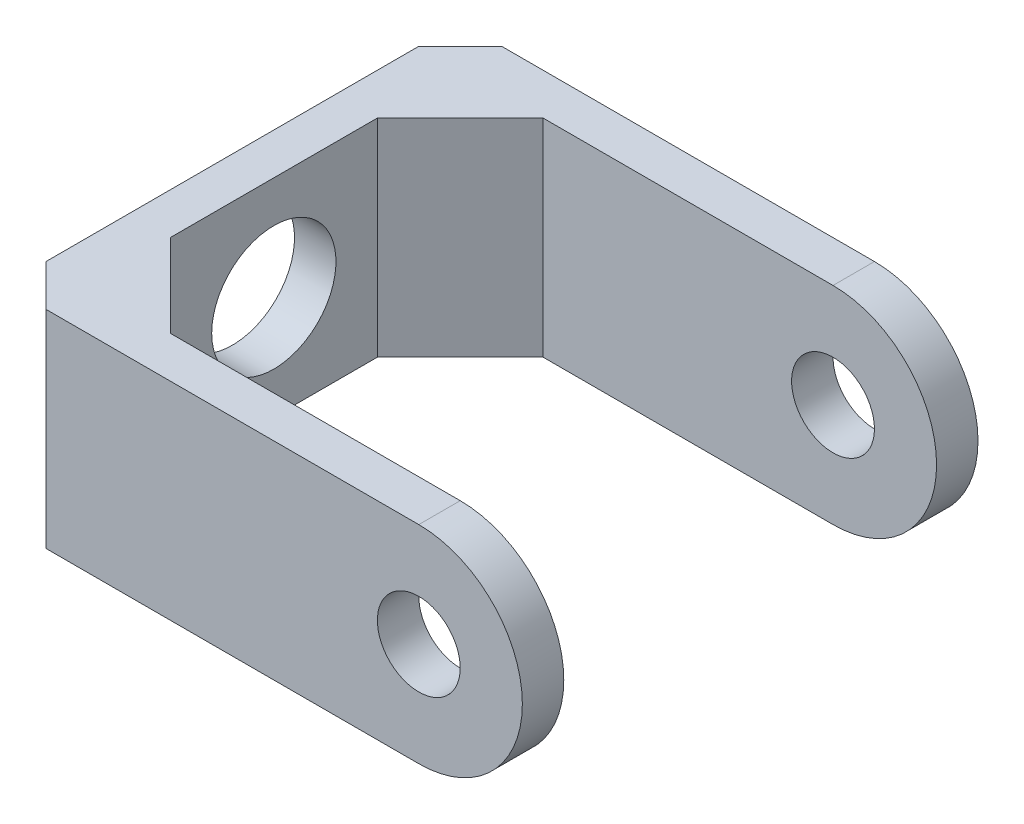
from build123d import *

# Parameters (mm, degrees)
SKETCH_1_R          = 2
EXTRUDE_1_DEPTH     = 2
SKETCH_6_W          = 22
SKETCH_6_H          = 10
EXTRUDE_5_DEPTH     = 2
CHAMFER_2_SIZE      = 2
CHAMFER_3_SIZE      = 4
SKETCH_7_R          = 3
CUT_EXTRUDE_2_DEPTH = 35.770677301


with BuildPart() as part:
    # 草图1 → 凸台-拉伸1 (new body)
    with BuildSketch(Plane.XY):
        with BuildLine():
            Line((0, 0), (18, 0))
            ThreePointArc((18, 0), (23, 5), (18, 10))
            Line((18, 10), (0, 10))
            Line((0, 10), (0, 0))
        make_face()
        with Locations((18, 5)):
            Circle(SKETCH_1_R, mode=Mode.SUBTRACT)
    extrude(amount=EXTRUDE_1_DEPTH)


with BuildPart() as body_2:
    # 镜向1: mirrored copy
    add(part.part.mirror(Plane.XY.offset(11)))


with BuildPart() as part_1:
    add(part.part)

    add(body_2.part)  # 凸台-拉伸5 merges body 2
    # 草图6 → 凸台-拉伸5 (add)
    with BuildSketch(Plane.ZY):
        with Locations((11, 5)):
            Rectangle(SKETCH_6_W, SKETCH_6_H)
    extrude(amount=EXTRUDE_5_DEPTH)

    # 倒角2
    chamfer_2_edges = [part_1.edges().sort_by_distance(p)[0] for p in [
        (-2, 5, 0),
        (-2, 5, 22),
    ]]
    chamfer(chamfer_2_edges, length=CHAMFER_2_SIZE)

    # 倒角3
    chamfer_3_edges = [part_1.edges().sort_by_distance(p)[0] for p in [
        (0, 5, 20),
        (0, 5, 2),
    ]]
    chamfer(chamfer_3_edges, length=CHAMFER_3_SIZE)

    # 草图7 → 切除-拉伸2 (cut, through all)
    with BuildSketch(Plane.ZY.offset(2)):
        with Locations((11, 5)):
            Circle(SKETCH_7_R)
    extrude(amount=-CUT_EXTRUDE_2_DEPTH, mode=Mode.SUBTRACT)


solid = part_1.part
